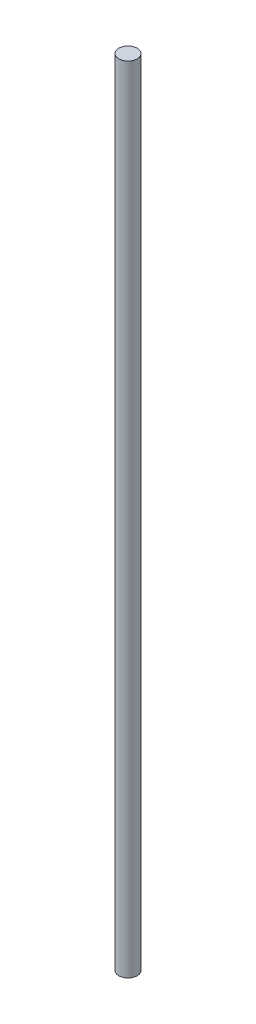
from build123d import *

# Parameters (mm, degrees)
SKETCH1_R           = 4
BOSS_EXTRUDE1_DEPTH = 345


with BuildPart() as part:
    # Sketch1 → Boss-Extrude1 (new body)
    with BuildSketch(Plane(origin=(0, 0, 0), x_dir=(1, 0, 0), z_dir=(0, 1, 0))):
        with Locations(Location((-10.677142154, -0.935003974, 0), (0, 0, 270))):
            Circle(SKETCH1_R)
    extrude(amount=BOSS_EXTRUDE1_DEPTH)


solid = part.part
